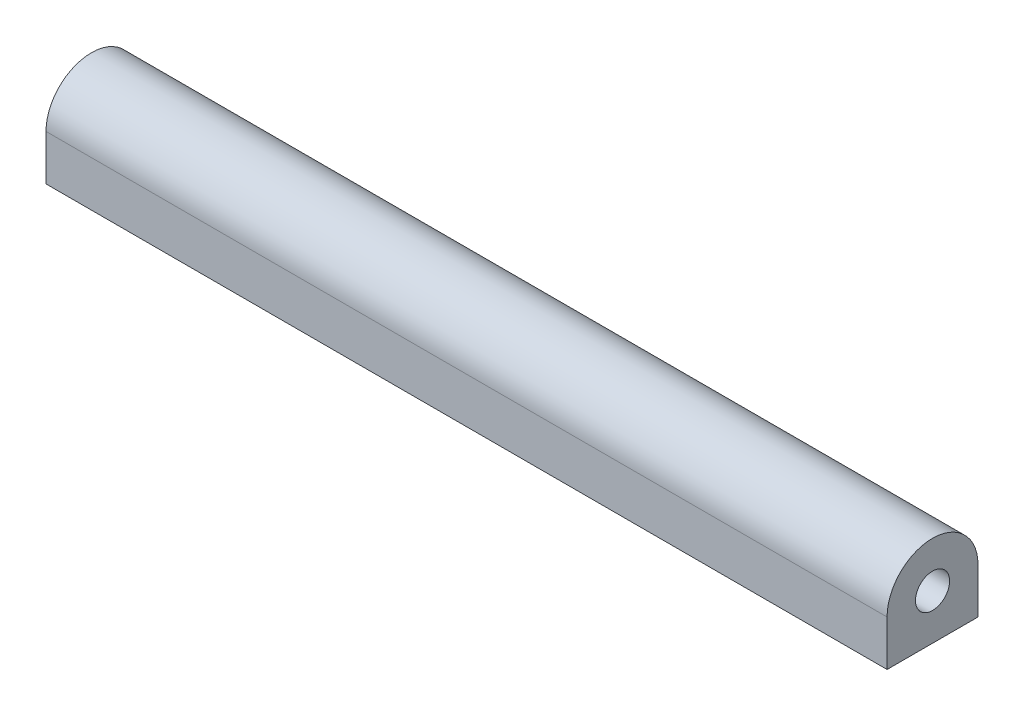
from build123d import *

# Parameters (mm, degrees)
SKETCH1_R           = 1.5
BOSS_EXTRUDE1_DEPTH = 74


with BuildPart() as part:
    # Sketch1 → Boss-Extrude1 (new body)
    with BuildSketch(Plane(origin=(0, 0, 0), x_dir=(0, 0, -1), z_dir=(1, 0, 0))):
        with BuildLine():
            Line((-4, 0), (-4, -4))
            Line((-4, -4), (4, -4))
            Line((4, -4), (4, 0))
            ThreePointArc((4, 0), (0, 4), (-4, 0))
        make_face()
        Circle(SKETCH1_R, mode=Mode.SUBTRACT)
    extrude(amount=BOSS_EXTRUDE1_DEPTH)


solid = part.part
